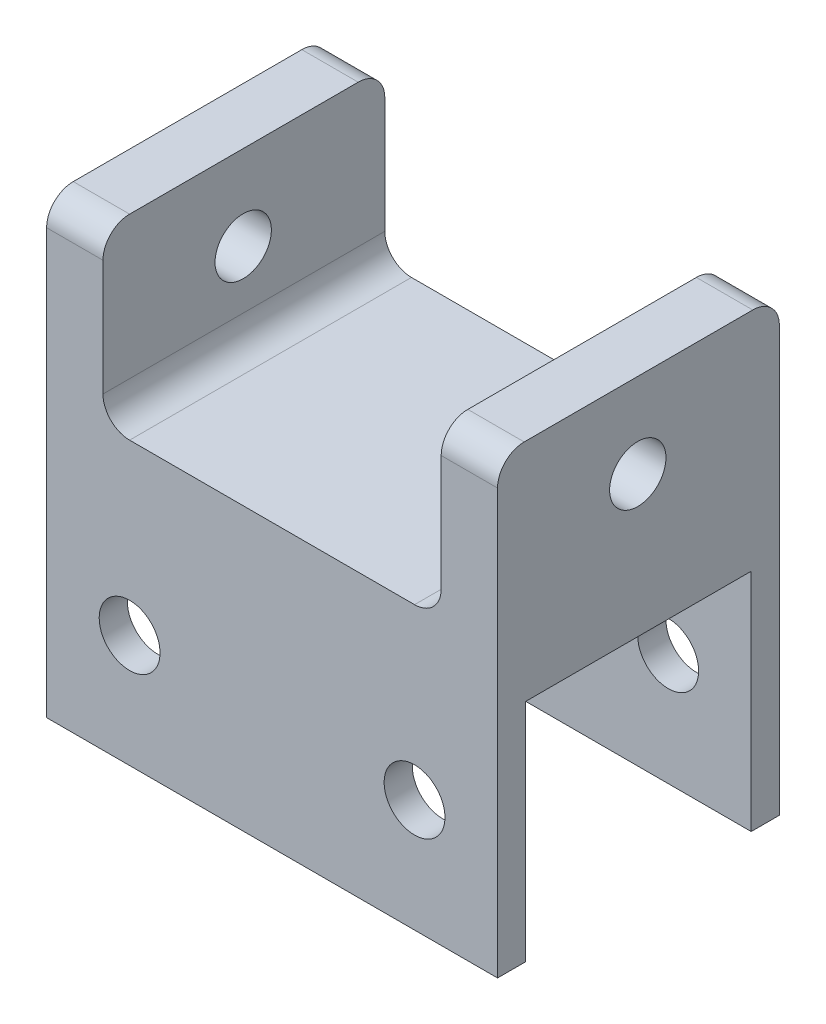
from build123d import *

# Parameters (mm, degrees)
SKETCH1_W               = 50.8
SKETCH1_H               = 31.75
BOSS_EXTRUDE1_DEPTH     = 31.75
SKETCH2_W               = 25.4
SKETCH2_H               = 25.4
CUT_EXTRUDE1_DEPTH      = 85.79053849
SKETCH3_W               = 6.35
SKETCH3_H               = 31.75
BOSS_EXTRUDE2_DEPTH     = 19.05
SKETCH4_W               = 6.35
SKETCH4_H               = 31.75
BOSS_EXTRUDE3_DEPTH     = 19.05
CUT_EXTRUDE2_DEPTH      = 91.317082645
CUT_EXTRUDE2_DEPTH_BACK = 91.317082645
SKETCH5_R               = 3.175
FILLET1_R               = 3
SKETCH6_R               = 3.429
CUT_EXTRUDE3_DEPTH      = 126.026704643
SKETCH7_R               = 3.429
CUT_EXTRUDE4_DEPTH      = 126.026704643


with BuildPart() as part:
    # Sketch1 → Boss-Extrude1 (new body)
    with BuildSketch(Plane(origin=(0, 0, 0), x_dir=(1, 0, 0), z_dir=(0, 1, 0))):
        with Locations((-84.340486484, 44.131107335)):
            Rectangle(SKETCH1_W, SKETCH1_H)
    extrude(amount=BOSS_EXTRUDE1_DEPTH)

    # Sketch2 → Cut-Extrude1 (cut, through all)
    with BuildSketch(Plane(origin=(-58.940486484, 0, 0), x_dir=(0, 0, -1), z_dir=(1, 0, 0))):
        with Locations((44.131107335, 12.7)):
            Rectangle(SKETCH2_W, SKETCH2_H)
    extrude(amount=-CUT_EXTRUDE1_DEPTH, mode=Mode.SUBTRACT)

    # Sketch3 → Boss-Extrude2 (add)
    with BuildSketch(Plane(origin=(0, 31.75, 0), x_dir=(1, 0, 0), z_dir=(0, 1, 0))):
        with Locations((-106.565486484, 44.131107335)):
            Rectangle(SKETCH3_W, SKETCH3_H)
    extrude(amount=BOSS_EXTRUDE2_DEPTH)

    # Sketch4 → Boss-Extrude3 (add)
    with BuildSketch(Plane(origin=(0, 31.75, 0), x_dir=(1, 0, 0), z_dir=(0, 1, 0))):
        with Locations((-62.115486484, 44.131107335)):
            Rectangle(SKETCH4_W, SKETCH4_H)
    extrude(amount=BOSS_EXTRUDE3_DEPTH)

    # Sketch5 → Cut-Extrude2 (cut, two sides: drawn at the far end of the back side and taken through both)
    with BuildSketch(Plane(origin=(-103.390486484, 0, 0), x_dir=(0, 0, -1), z_dir=(1, 0, 0)).offset(-CUT_EXTRUDE2_DEPTH_BACK)):
        with Locations((44.053057169, 41.275)):
            Circle(SKETCH5_R)
    extrude(amount=CUT_EXTRUDE2_DEPTH + CUT_EXTRUDE2_DEPTH_BACK, mode=Mode.SUBTRACT)

    # Fillet1
    fillet1_edges = [part.edges().sort_by_distance(p)[0] for p in [
        (-106.565486484, 50.8, -60.006107335),
        (-106.565486484, 50.8, -28.256107335),
        (-62.115486484, 50.8, -28.256107335),
        (-62.115486484, 50.8, -60.006107335),
        (-65.290486484, 31.75, -44.131107335),
        (-103.390486484, 31.75, -44.131107335),
    ]]
    fillet(fillet1_edges, radius=FILLET1_R)

    # Sketch6 → Cut-Extrude3 (cut, through all)
    with BuildSketch(Plane(origin=(0, 0, -60.006107335), x_dir=(-1, 0, 0), z_dir=(0, 0, -1))):
        with Locations((68.290486484, 12.7)):
            Circle(SKETCH6_R)
    extrude(amount=-CUT_EXTRUDE3_DEPTH, mode=Mode.SUBTRACT)

    # Sketch7 → Cut-Extrude4 (cut, through all)
    with BuildSketch(Plane(origin=(0, 0, -60.006107335), x_dir=(-1, 0, 0), z_dir=(0, 0, -1))):
        with Locations((100.390486484, 12.7)):
            Circle(SKETCH7_R)
    extrude(amount=-CUT_EXTRUDE4_DEPTH, mode=Mode.SUBTRACT)


solid = part.part
